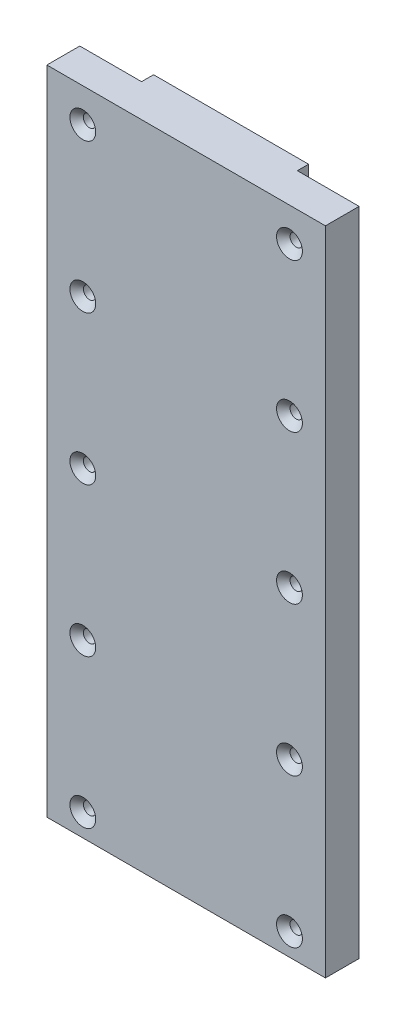
from build123d import *

# Parameters (mm, degrees)
SKETCH2_W                  = 580
SKETCH2_H                  = 248
BOSS_EXTRUDE1_DEPTH        = 20
SKETCH3_W                  = 55
SKETCH3_H                  = 10.706810323
SKETCH3_H_2                = 10
CUT_EXTRUDE1_DEPTH         = 594.444184402
F_11_0_11_DIAMETER_HOLE1_D = 11
LPATTERN1_COUNT            = 5
LPATTERN1_PITCH            = 132.5
CHAMFER1_SIZE              = 6


with BuildPart() as part:
    # Sketch2 → Boss-Extrude1 (new, symmetric)
    with BuildSketch(Plane(origin=(0, 0, 0), x_dir=(0, 1, 0), z_dir=(0, 0, 1))):
        Rectangle(SKETCH2_W, SKETCH2_H)
    extrude(amount=BOSS_EXTRUDE1_DEPTH, both=True)

    # Sketch3 → Cut-Extrude1 (cut, through all)
    with BuildSketch(Plane(origin=(0, 290, 0), x_dir=(-1, 0, 0), z_dir=(0, 1, 0))):
        with Locations((96.5, -14.646594839)):
            Rectangle(SKETCH3_W, SKETCH3_H)
        with Locations((-96.5, -15)):
            Rectangle(SKETCH3_W, SKETCH3_H_2)
    extrude(amount=-CUT_EXTRUDE1_DEPTH, mode=Mode.SUBTRACT)

    # Ø11.0 (11) Diameter Hole1 (through all)
    with Locations(Plane(origin=(-92, -270, 20), x_dir=(1, 0, 0), z_dir=(0, 0, 1))):
        with Locations((0, 0), (184, 0)):
            f_11_0_11_diameter_hole1 = Hole(F_11_0_11_DIAMETER_HOLE1_D / 2)

    # LPattern1: Ø11.0 (11) Diameter Hole1 ×5
    with Locations(*[(0, i * LPATTERN1_PITCH, 0) for i in range(1, LPATTERN1_COUNT)]):
        add(f_11_0_11_diameter_hole1, mode=Mode.SUBTRACT)

    # Chamfer1
    chamfer1_edges = [part.edges().sort_by_distance(p)[0] for p in [
        (97.5, -270, 20),
        (-86.5, -270, 20),
        (97.5, -137.5, 20),
        (-86.5, -137.5, 20),
        (97.5, -5, 20),
        (-86.5, -5, 20),
        (97.5, 127.5, 20),
        (-86.5, 127.5, 20),
        (97.5, 260, 20),
        (-86.5, 260, 20),
    ]]
    chamfer(chamfer1_edges, length=CHAMFER1_SIZE)


solid = part.part
